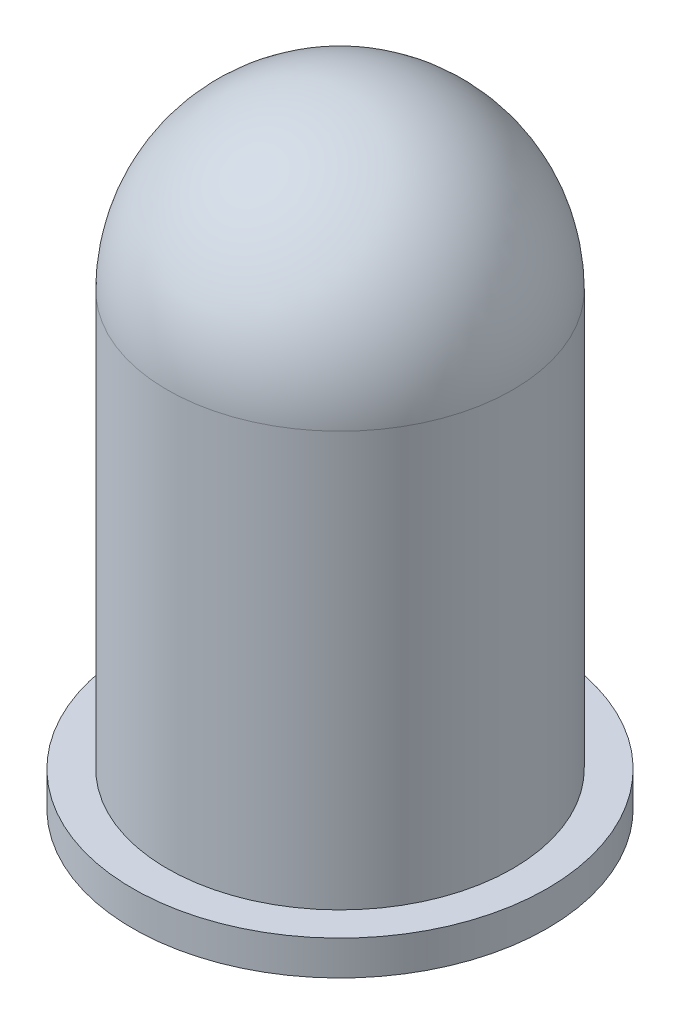
from build123d import *


with BuildPart() as part:
    # Sketch1 → Revolve1 (revolve)
    with BuildSketch(Plane.XY, mode=Mode.PRIVATE) as revolve1_sk:
        with BuildLine():
            Line((0, 0), (-3, 0))
            Line((-3, 0), (-3, 0.5))
            Line((-3, 0.5), (-2.5, 0.5))
            Line((-2.5, 0.5), (-2.5, 6.5))
            ThreePointArc((-2.5, 6.5), (-1.767766953, 8.267766953), (0, 9))
            Line((0, 9), (0, 0))
        make_face()
    revolve(revolve1_sk.sketch.rotate(Axis((0, -624.028498716, 0), (0, 1, 0)), 180), axis=Axis((0, -624.028498716, 0), (0, 1, 0)))


solid = part.part
